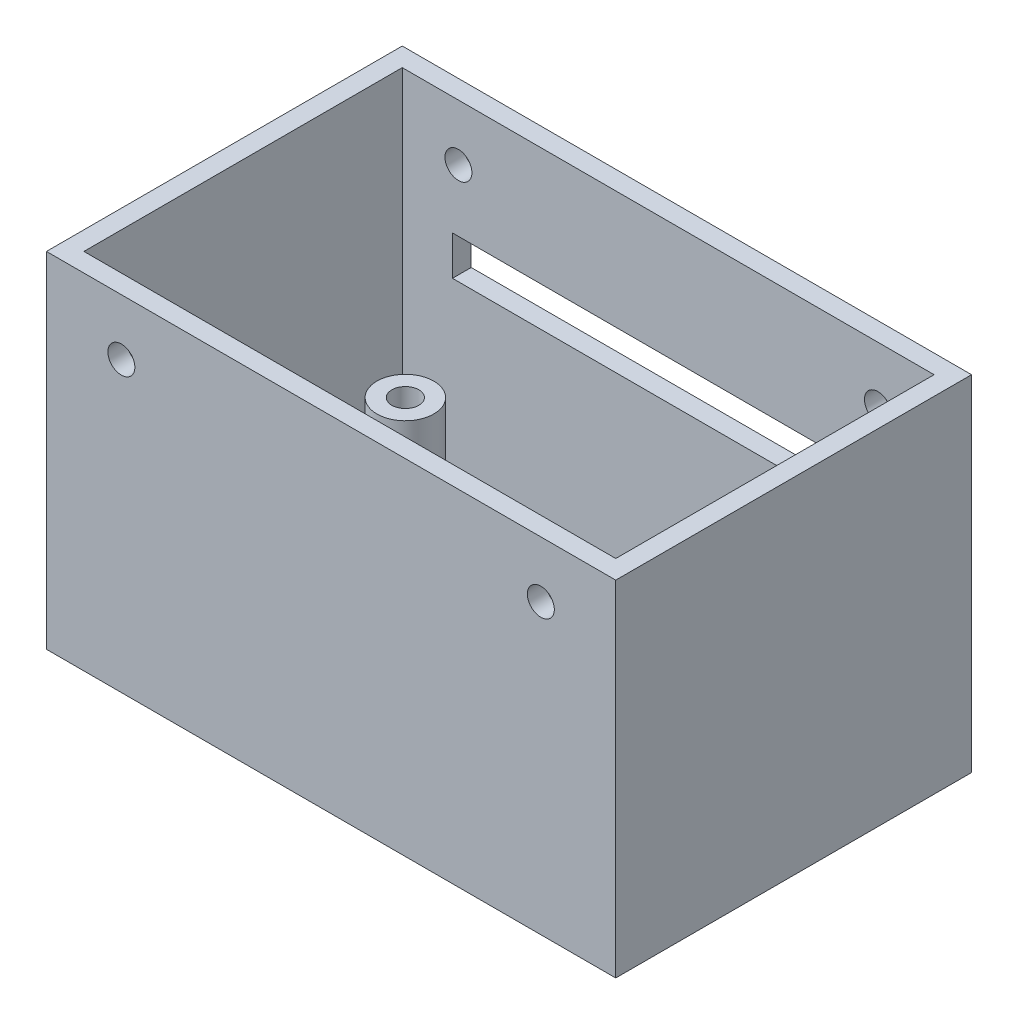
from build123d import *

# Parameters (mm, degrees)
SKETCH1_W           = 152
SKETCH1_H           = 95
BOSS_EXTRUDE2_DEPTH = 92
SKETCH3_W           = 142
SKETCH3_H           = 85
CUT_EXTRUDE2_DEPTH  = 86
SKETCH5_R           = 7.6
SKETCH5_R_2         = 3.6
BOSS_EXTRUDE7_DEPTH = 25.4
SKETCH8_R           = 3.6
CUT_EXTRUDE3_DEPTH  = 202.477045839
SKETCH10_R          = 5
CUT_EXTRUDE7_DEPTH  = 202.477045839
SKETCH13_W          = 115.430222659
SKETCH13_H          = 10.493656606
CUT_EXTRUDE8_DEPTH  = 10


with BuildPart() as part:
    # Sketch1 → Boss-Extrude2 (new body)
    with BuildSketch(Plane(origin=(0, 0, 0), x_dir=(1, 0, 0), z_dir=(0, 1, 0))):
        with Locations((76, 47.5)):
            Rectangle(SKETCH1_W, SKETCH1_H)
    extrude(amount=BOSS_EXTRUDE2_DEPTH)

    # Sketch3 → Cut-Extrude2 (cut)
    with BuildSketch(Plane(origin=(0, 92, 0), x_dir=(1, 0, 0), z_dir=(0, 1, 0))):
        with Locations((76, 47.5)):
            Rectangle(SKETCH3_W, SKETCH3_H)
    extrude(amount=-CUT_EXTRUDE2_DEPTH, mode=Mode.SUBTRACT)

    # Sketch5 → Boss-Extrude7 (add)
    # profile 1 of 4: a face of its own
    with BuildSketch(Plane(origin=(0, 6, 0), x_dir=(1, 0, 0), z_dir=(0, 1, 0))):
        with Locations(Location((20.845338855, 18.593594881, 0), (0, 0, 270))):
            Circle(SKETCH5_R)
        with Locations(Location((20.845338855, 18.593594881, 0), (0, 0, 270))):
            Circle(SKETCH5_R_2, mode=Mode.SUBTRACT)
    # profile 2 of 4: a face of its own
    with BuildSketch(Plane(origin=(0, 6, 0), x_dir=(1, 0, 0), z_dir=(0, 1, 0))):
        with Locations(Location((21.099338855, 74.727594881, 0), (0, 0, 270))):
            Circle(SKETCH5_R)
        with Locations(Location((21.099338855, 74.727594881, 0), (0, 0, 270))):
            Circle(SKETCH5_R_2, mode=Mode.SUBTRACT)
    # profile 3 of 4: a face of its own
    with BuildSketch(Plane(origin=(0, 6, 0), x_dir=(1, 0, 0), z_dir=(0, 1, 0))):
        with Locations(Location((129.303338855, 17.069594881, 0), (0, 0, 270))):
            Circle(SKETCH5_R)
        with Locations(Location((129.303338855, 17.069594881, 0), (0, 0, 270))):
            Circle(SKETCH5_R_2, mode=Mode.SUBTRACT)
    # profile 4 of 4: a face of its own
    with BuildSketch(Plane(origin=(0, 6, 0), x_dir=(1, 0, 0), z_dir=(0, 1, 0))):
        with Locations(Location((129.049338855, 75.235594881, 0), (0, 0, 270))):
            Circle(SKETCH5_R)
        with Locations(Location((129.049338855, 75.235594881, 0), (0, 0, 270))):
            Circle(SKETCH5_R_2, mode=Mode.SUBTRACT)
    extrude(amount=BOSS_EXTRUDE7_DEPTH)

    # Sketch8 → Cut-Extrude3 (cut, through all)
    with BuildSketch(Plane.XY):
        with Locations((20, 77)):
            Circle(SKETCH8_R)
        with Locations((132, 77)):
            Circle(SKETCH8_R)
    extrude(amount=-CUT_EXTRUDE3_DEPTH, mode=Mode.SUBTRACT)

    # Sketch10 → Cut-Extrude7 (cut, through all)
    with BuildSketch(Plane.XZ):
        with Locations(Location((35.489604733, -46.401826634, 0), (0, 0, 270))):
            Circle(SKETCH10_R)
        with Locations(Location((115.489604737, -46.401826637, 0), (0, 0, 270))):
            Circle(SKETCH10_R)
    extrude(amount=-CUT_EXTRUDE7_DEPTH, mode=Mode.SUBTRACT)

    # Sketch13 → Cut-Extrude8 (cut)
    with BuildSketch(Plane(origin=(0, 0, -95), x_dir=(-1, 0, 0), z_dir=(0, 0, -1))):
        with Locations((-76.122019263, 55.234418237)):
            Rectangle(SKETCH13_W, SKETCH13_H)
    extrude(amount=-CUT_EXTRUDE8_DEPTH, mode=Mode.SUBTRACT)


solid = part.part
